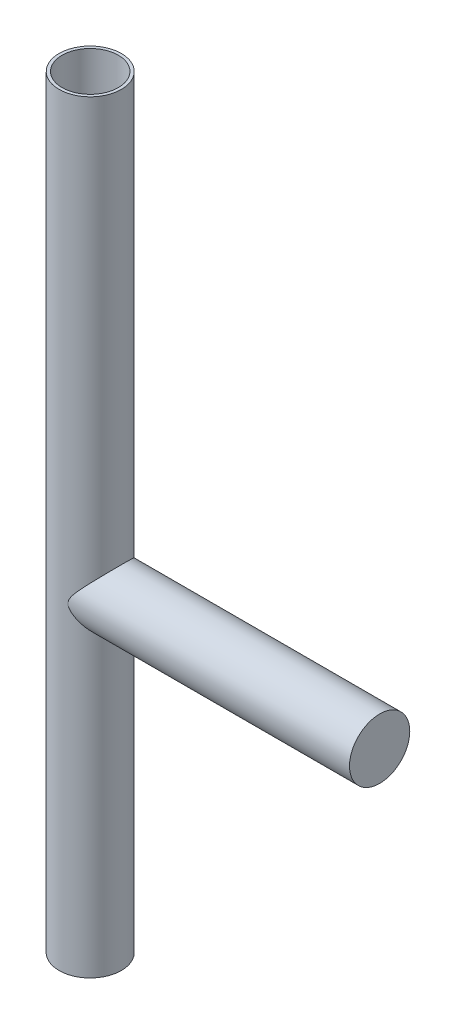
from build123d import *

# Parameters (mm, degrees)
BOSS_EXTRUDE1_DEPTH      = 160
BOSS_EXTRUDE1_DEPTH_BACK = 5
SKETCH1_R                = 7.75
SKETCH1_R_2              = 7
SKETCH5_R                = 7.5
BOSS_EXTRUDE3_DEPTH      = 72.0622032
SKETCH7_R                = 7.75
SKETCH7_R_2              = 7
BOSS_EXTRUDE5_DEPTH      = 25


with BuildPart() as part:
    # Sketch1 → Boss-Extrude1 (new, two sides: drawn at the far end of the back side and taken through both)
    with BuildSketch(Plane(origin=(0, 0, 0), x_dir=(1, 0, 0), z_dir=(0, 1, 0)).offset(-BOSS_EXTRUDE1_DEPTH_BACK)):
        with Locations(Location((0, 0, 0), (0, 0, 270))):
            Circle(SKETCH1_R)
        with Locations(Location((0, 0, 0), (0, 0, 270))):
            Circle(SKETCH1_R_2, mode=Mode.SUBTRACT)
    extrude(amount=BOSS_EXTRUDE1_DEPTH + BOSS_EXTRUDE1_DEPTH_BACK)

    # Sketch5 → Boss-Extrude3 (add)
    with BuildSketch(Plane(origin=(0, 0, 0), x_dir=(0, 0, -1), z_dir=(1, 0, 0))):
        with Locations(Location((0, 75, 0), (0, 0, 180))):
            Circle(SKETCH5_R)
    extrude(amount=BOSS_EXTRUDE3_DEPTH)

    # Sketch7 → Boss-Extrude5 (add)
    with BuildSketch(Plane(origin=(0, 160, 0), x_dir=(1, 0, 0), z_dir=(0, 1, 0))):
        with Locations(Location((0, 0, 0), (0, 0, 270))):
            Circle(SKETCH7_R)
        with Locations(Location((0, 0, 0), (0, 0, 270))):
            Circle(SKETCH7_R_2, mode=Mode.SUBTRACT)
    extrude(amount=BOSS_EXTRUDE5_DEPTH)


solid = part.part
